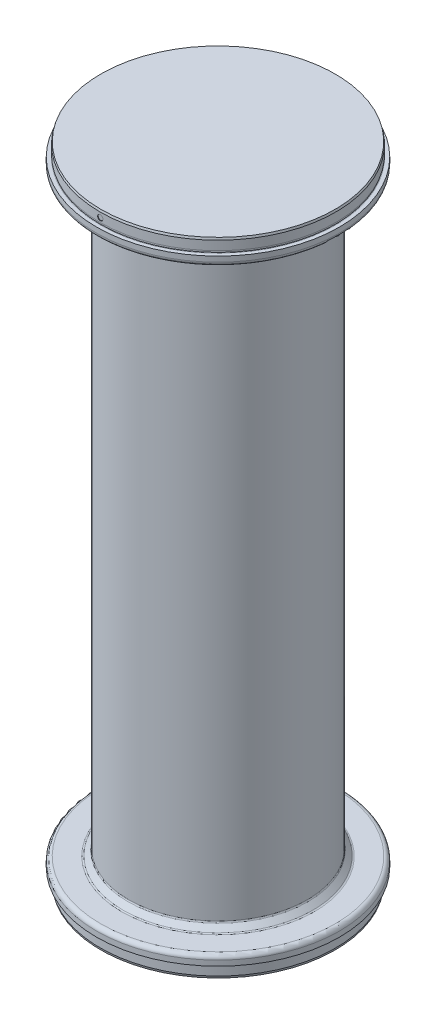
from build123d import *
from OCP.BRepFilletAPI import BRepFilletAPI_MakeChamfer

# Parameters (mm, degrees)
SKETCH2_R           = 56
BOSS_EXTRUDE1_DEPTH = 5.3
BOSS_EXTRUDE2_START = 5.3
SKETCH4_R           = 56
BOSS_EXTRUDE2_DEPTH = 5.3
SKETCH6_W           = 0.281968922
SKETCH6_H           = 1.25
CHAMFER1_SIZE       = 0.267949192
CHAMFER1_SIZE2      = 1
FILLET1_R           = 1
FILLET3_R           = 2


with BuildPart() as part:
    # Sketch1 → Revolve1 (revolve)
    with BuildSketch(Plane(origin=(0, 0, 0), x_dir=(-1, 0, 0), z_dir=(0, 0, -1)), mode=Mode.PRIVATE) as revolve1_sk:
        with BuildLine():
            Line((-56, -299.7), (0, -299.7))
            Line((0, -299.7), (0, -5.3))
            Line((0, -5.3), (-56, -5.3))
            ThreePointArc((-56, -5.3), (-55.860484091, -5.319859072), (-55.732050808, -5.377858756))
            Line((-55.732050808, -5.377858756), (-55.732050808, -6.222141244))
            ThreePointArc((-55.732050808, -6.222141244), (-55.860484091, -6.280140928), (-56, -6.3))
            Line((-56, -6.3), (-57.75, -6.3))
            Line((-57.75, -6.3), (-57.75, -10.8))
            Line((-57.75, -10.8), (-45.4, -10.8))
            Line((-45.4, -10.8), (-42.5, -13.7))
            Line((-42.5, -13.7), (-42.5, -291.3))
            Line((-42.5, -291.3), (-45.4, -294.2))
            Line((-45.4, -294.2), (-57.75, -294.2))
            Line((-57.75, -294.2), (-57.75, -298.7))
            Line((-57.75, -298.7), (-56, -298.7))
            ThreePointArc((-56, -298.7), (-55.860484091, -298.719859072), (-55.732050808, -298.777858756))
            Line((-55.732050808, -298.777858756), (-55.732050808, -299.622141244))
            ThreePointArc((-55.732050808, -299.622141244), (-55.860484091, -299.680140928), (-56, -299.7))
        make_face()
    revolve(revolve1_sk.sketch.rotate(Axis((0, -299.7, 0), (0, 1, 0)), 270), axis=Axis((0, -299.7, 0), (0, 1, 0)))

    # Sketch2 → Boss-Extrude1 (add)
    with BuildSketch(Plane.XZ.offset(299.7)):
        with Locations(Location((0, 0, 0), (0, 0, 270))):
            Circle(SKETCH2_R)
    extrude(amount=BOSS_EXTRUDE1_DEPTH)

    # Sketch4 → Boss-Extrude2 (add)
    with BuildSketch(Plane(origin=(0, -5.3, 0), x_dir=(-1, 0, 0), z_dir=(0, 1, 0)).offset(BOSS_EXTRUDE2_START)):
        with Locations(Location((0, 0, 0), (0, 0, 270))):
            Circle(SKETCH4_R)
    extrude(amount=-BOSS_EXTRUDE2_DEPTH)

    # Sketch6 → Cut-Revolve1 (revolve, cut)
    with BuildSketch(Plane(origin=(0, 0, 0), x_dir=(0, 0, -1), z_dir=(1, 0, 0)), mode=Mode.PRIVATE) as cut_revolve1_sk:
        with Locations((-55.859015539, -3.925)):
            Rectangle(SKETCH6_W, SKETCH6_H)
    revolve(cut_revolve1_sk.sketch.rotate(Axis((0, -3.3, 55.718031078), (0, 0, 1)), 90), axis=Axis((0, -3.3, 55.718031078), (0, 0, 1)), mode=Mode.SUBTRACT)

    # Chamfer1: one chamfer whose edges measure the first distance from different faces: ONE call of the kernel's chamfer builder (chamfer() names one face for all edges)
    chamfer1_edges_1 = [part.edges().sort_by_distance(p)[0] for p in [
        (0, -305, 56),
    ]]
    chamfer1_side_1 = [part.faces().sort_by_distance(p)[0] for p in [
        (0, -305, 0),
    ]]
    chamfer1_edges_2 = [part.edges().sort_by_distance(p)[0] for p in [
        (0, 0, 56),
    ]]
    chamfer1_side_2 = [part.faces().sort_by_distance(p)[0] for p in [
        (0, 0, 0),
    ]]
    chamfer1 = BRepFilletAPI_MakeChamfer(part.part.solid().wrapped)
    for e in chamfer1_edges_1:
        chamfer1.Add(CHAMFER1_SIZE, CHAMFER1_SIZE2, e.wrapped, chamfer1_side_1[0].wrapped)  # the first distance lies on this face
    for e in chamfer1_edges_2:
        chamfer1.Add(CHAMFER1_SIZE, CHAMFER1_SIZE2, e.wrapped, chamfer1_side_2[0].wrapped)  # the first distance lies on this face
    add(Compound.cast(chamfer1.Shape()), mode=Mode.REPLACE)

    # Fillet1
    fillet1_edges = [part.edges().sort_by_distance(p)[0] for p in [
        (0, -294.2, -45.4),
        (0, -291.3, -42.5),
        (0, -13.7, -42.5),
        (0, -10.8, -45.4),
    ]]
    fillet(fillet1_edges, radius=FILLET1_R)

    # Fillet3
    fillet3_edges = [part.edges().sort_by_distance(p)[0] for p in [
        (0, -294.2, -57.75),
        (0, -10.8, -57.75),
    ]]
    fillet(fillet3_edges, radius=FILLET3_R)


solid = part.part
